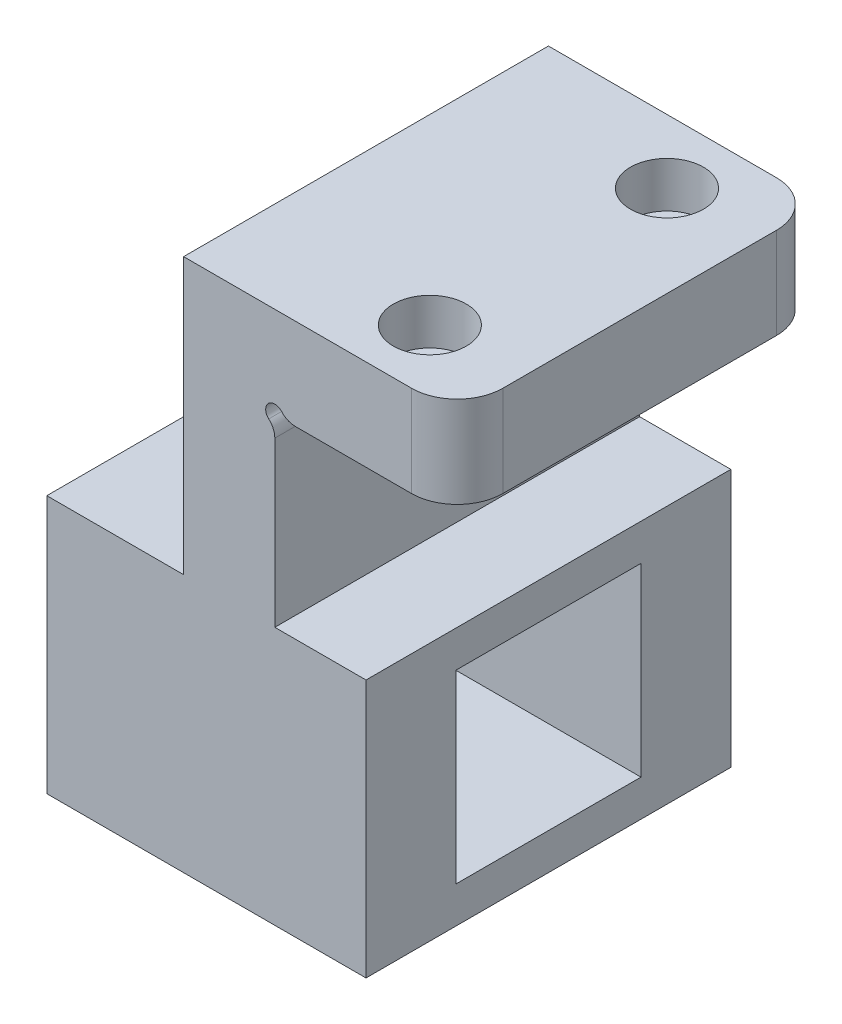
from build123d import *

# Parameters (mm, degrees)
DODANIE_WYCI_GNI_CIE1_DEPTH = 40
SZKIC7_R                    = 4
WYTNIJ_WYCI_GNI_CIE2_DEPTH  = 5
SZKIC8_R                    = 2.1
WYTNIJ_WYCI_GNI_CIE3_DEPTH  = 5
SZKIC9_R                    = 4
WYTNIJ_WYCI_GNI_CIE4_DEPTH  = 5
SZKIC10_R                   = 2.1
WYTNIJ_WYCI_GNI_CIE5_DEPTH  = 5
ZAOKR_GLENIE1_R             = 5
BOSS_EXTRUDE1_DEPTH         = 15
BOSS_EXTRUDE1_DEPTH_BACK    = 20.0001
SKETCH1_W                   = 40
SKETCH1_H                   = 28.3
SKETCH1_W_2                 = 20.3
SKETCH1_H_2                 = 20.3


with BuildPart() as part:
    # Szkic1 → Dodanie-wyciągnięcie1 (new body)
    with BuildSketch(Plane.XY):
        with BuildLine():
            Line((0, 0), (0, 19.763932023))
            ThreePointArc((0, 19.763932023), (-0.174258142, 20.580428603), (-0.666666667, 21.254644008))
            ThreePointArc((-0.666666667, 21.254644008), (-0.707106781, 22.707106781), (0.745355992, 22.666666667))
            ThreePointArc((0.745355992, 22.666666667), (1.419571397, 22.174258142), (2.236067977, 22))
            Line((2.236067977, 22), (20, 22))
            Line((20, 22), (20, 32))
            Line((20, 32), (-10, 32))
            Line((-10, 32), (-10, 0))
            Line((-10, 0), (0, 0))
        make_face()
    extrude(amount=DODANIE_WYCI_GNI_CIE1_DEPTH)

    # Szkic7 → Wytnij-wyciągnięcie2 (cut)
    with BuildSketch(Plane.ZY.offset(10)):
        with Locations(Location((20, 10, 0), (0, 0, 270))):
            Circle(SZKIC7_R)
    extrude(amount=-WYTNIJ_WYCI_GNI_CIE2_DEPTH, mode=Mode.SUBTRACT)

    # Szkic8 → Wytnij-wyciągnięcie3 (cut)
    with BuildSketch(Plane.ZY.offset(5)):
        with Locations(Location((20, 10, 0), (0, 0, 270))):
            Circle(SZKIC8_R)
    extrude(amount=-WYTNIJ_WYCI_GNI_CIE3_DEPTH, mode=Mode.SUBTRACT)

    # Szkic9 → Wytnij-wyciągnięcie4 (cut)
    with BuildSketch(Plane(origin=(0, 32, 0), x_dir=(1, 0, 0), z_dir=(0, 1, 0))):
        with Locations(Location((10, -33, 0), (0, 0, 180))):
            Circle(SZKIC9_R)
        with Locations(Location((10, -7, 0), (0, 0, 180))):
            Circle(SZKIC9_R)
    extrude(amount=-WYTNIJ_WYCI_GNI_CIE4_DEPTH, mode=Mode.SUBTRACT)

    # Szkic10 → Wytnij-wyciągnięcie5 (cut)
    with BuildSketch(Plane(origin=(0, 27, 0), x_dir=(1, 0, 0), z_dir=(0, 1, 0))):
        with Locations(Location((10, -33, 0), (0, 0, 180))):
            Circle(SZKIC10_R)
        with Locations(Location((10, -7, 0), (0, 0, 180))):
            Circle(SZKIC10_R)
    extrude(amount=-WYTNIJ_WYCI_GNI_CIE5_DEPTH, mode=Mode.SUBTRACT)

    # Zaokrąglenie1
    zaokr_glenie1_edges = [part.edges().sort_by_distance(p)[0] for p in [
        (20, 27, 0),
        (20, 27, 40),
    ]]
    fillet(zaokr_glenie1_edges, radius=ZAOKR_GLENIE1_R)

    # Sketch1 → Boss-Extrude1 (add, two sides: drawn at the far end of the back side and taken through both)
    with BuildSketch(Plane.ZY.offset(10).offset(-BOSS_EXTRUDE1_DEPTH_BACK)):
        with Locations((20, -12.35)):
            Rectangle(SKETCH1_W, SKETCH1_H)
        with Locations((20, -12.35)):
            Rectangle(SKETCH1_W_2, SKETCH1_H_2, mode=Mode.SUBTRACT)
    extrude(amount=BOSS_EXTRUDE1_DEPTH + BOSS_EXTRUDE1_DEPTH_BACK)


solid = part.part
